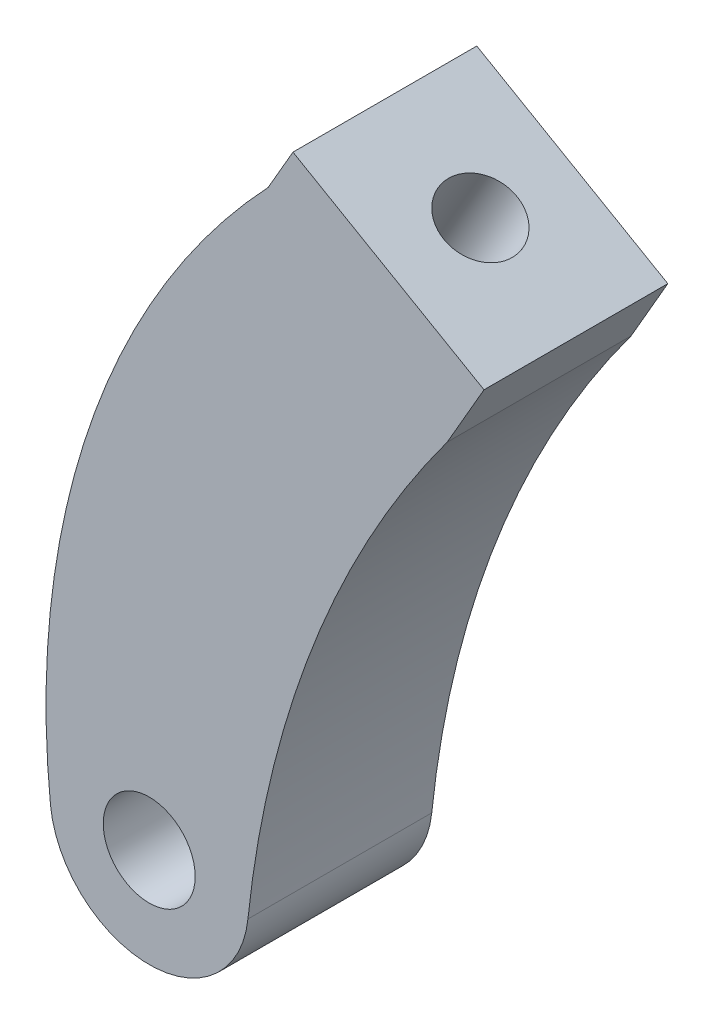
from build123d import *

# Parameters (mm, degrees)
ESQUISSE1_R        = 12.5
BOSS_EXTRU_1_DEPTH = 25


with BuildPart() as part:
    # Esquisse1 → Boss.-Extru.1 (new, symmetric)
    with BuildSketch(Plane.XY):
        with BuildLine():
            Line((83.869153377, -119.714830661), (93.869153377, -102.394322585))
            Line((93.869153377, -102.394322585), (41.907629149, -72.394322585))
            Line((41.907629149, -72.394322585), (35.151654556, -84.096013836))
            ThreePointArc((35.151654556, -84.096013836), (-13.596595867, -165.15744642), (-24.048474301, -259.168647929))
            ThreePointArc((-24.048474301, -259.168647929), (2.80386651, -283.348755554), (29.65620732, -259.168647929))
            ThreePointArc((29.65620732, -259.168647929), (47.428924329, -185.813223264), (83.869153377, -119.714830661))
        make_face()
        with Locations((2.80386651, -256.348755554)):
            Circle(ESQUISSE1_R, mode=Mode.SUBTRACT)
    extrude(amount=BOSS_EXTRU_1_DEPTH, both=True)

    # Esquisse3 → Enlèvement de matière-Révolution1 (revolve, cut)
    with BuildSketch(Plane.XY):
        Polygon((67.888391263, -87.394322585), (50.388391263, -117.705211717), (44.614888571, -107.705211717), (59.228137225, -82.394322585), align=None)
    revolve(axis=Axis((67.888391263, -87.394322585, 0), (-0.5000000000000014, -0.8660254037844379, 0)), mode=Mode.SUBTRACT)


solid = part.part
